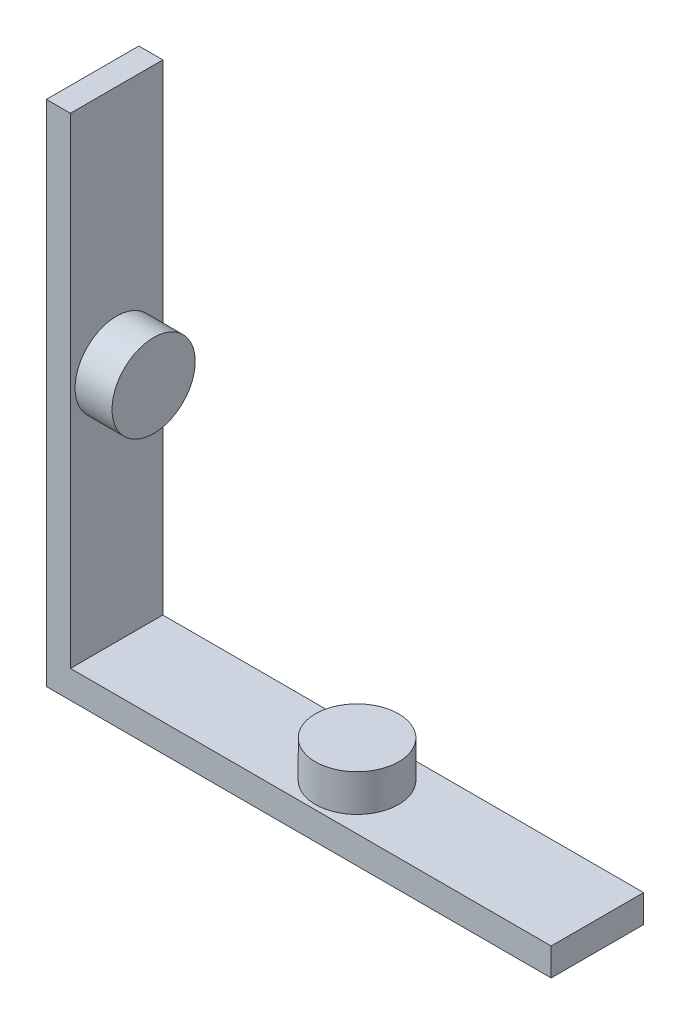
from build123d import *

# Parameters (mm, degrees)
BOSS_EXTRUDE1_DEPTH = 50
SKETCH2_R           = 22.5
BOSS_EXTRUDE2_DEPTH = 20
SKETCH3_R           = 22.5
BOSS_EXTRUDE3_DEPTH = 20
CHAMFER2_SIZE       = 2


with BuildPart() as part:
    # Sketch1 → Boss-Extrude1 (new body)
    with BuildSketch(Plane.XY):
        Polygon((0, 275), (0, 0), (275, 0), (275, 15), (15, 15), (15, 275), align=None)
    extrude(amount=BOSS_EXTRUDE1_DEPTH)

    # Sketch2 → Boss-Extrude2 (add)
    with BuildSketch(Plane(origin=(0, 15, 0), x_dir=(1, 0, 0), z_dir=(0, 1, 0))):
        with Locations((145, -25)):
            Circle(SKETCH2_R)
    extrude(amount=BOSS_EXTRUDE2_DEPTH)

    # Sketch3 → Boss-Extrude3 (add)
    with BuildSketch(Plane(origin=(15, 0, 0), x_dir=(0, 0, -1), z_dir=(1, 0, 0))):
        with Locations(Location((-25, 145, 0), (0, 0, 180))):
            Circle(SKETCH3_R)
    extrude(amount=BOSS_EXTRUDE3_DEPTH)

    # Chamfer2
    chamfer2_edges = [part.edges().sort_by_distance(p)[0] for p in [
        (0, 0, 25),
        (0, 275, 25),
        (0, 137.5, 0),
        (0, 137.5, 50),
    ]]
    chamfer(chamfer2_edges, length=CHAMFER2_SIZE)


solid = part.part
